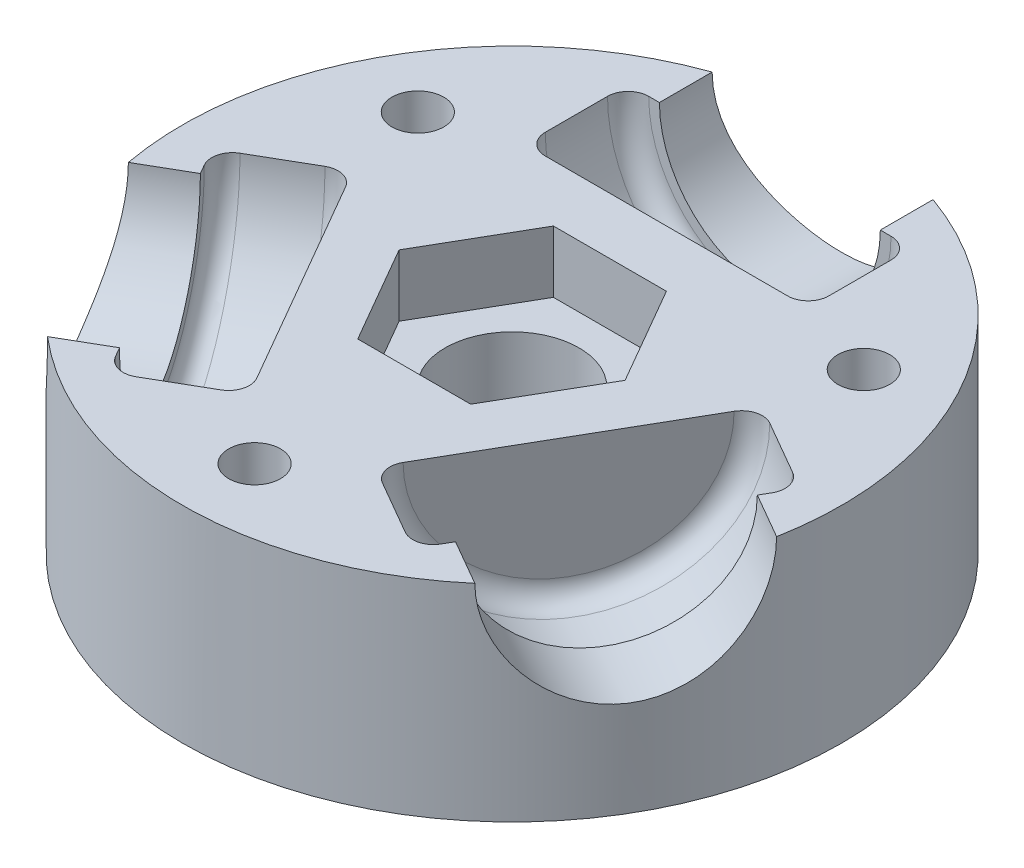
from build123d import *

# Parameters (mm, degrees)
SKETCH2_R                = 32
BOSS_EXTRUDE1_DEPTH      = 20
SKETCH3_R                = 10.725
CUT_EXTRUDE1_DEPTH       = 6.97
SKETCH4_R                = 13.765
CUT_EXTRUDE2_DEPTH       = 10.04
FILLET1_R                = 2
CIRPATTERN1_COUNT        = 3
FILLET1_OF_CIRPATTERN1_R = 2
SKETCH5_R                = 6.5
CUT_EXTRUDE3_DEPTH       = 20
SKETCH6_R                = 17.515
CUT_EXTRUDE4_DEPTH       = 3
SKETCH7_R                = 2.515
CUT_EXTRUDE5_DEPTH       = 20
CUT_EXTRUDE6_DEPTH       = 6


with BuildPart() as part:
    # Sketch2 → Boss-Extrude1 (new body)
    with BuildSketch(Plane(origin=(0, 0, 0), x_dir=(1, 0, 0), z_dir=(0, 1, 0))):
        with Locations(Location((0, 0, 0), (0, 0, 270))):
            Circle(SKETCH2_R)
    extrude(amount=BOSS_EXTRUDE1_DEPTH)

    # Sketch3 → Cut-Extrude1 (cut)
    with BuildSketch(Plane(origin=(0, 0, -32), x_dir=(-1, 0, 0), z_dir=(0, 0, -1))):
        with Locations((0, 20)):
            Circle(SKETCH3_R)
    cut_extrude1 = extrude(amount=-CUT_EXTRUDE1_DEPTH, mode=Mode.SUBTRACT)

    # Sketch4 → Cut-Extrude2 (cut)
    with BuildSketch(Plane(origin=(0, 0, -25.03), x_dir=(-1, 0, 0), z_dir=(0, 0, -1))):
        with Locations((0, 20)):
            Circle(SKETCH4_R)
    cut_extrude2 = extrude(amount=-CUT_EXTRUDE2_DEPTH, mode=Mode.SUBTRACT)

    # Fillet1
    fillet1_edges = [part.edges().sort_by_distance(p)[0] for p in [
        (0, 6.235, -25.03),
        (0, 6.235, -14.99),
    ]]
    fillet(fillet1_edges, radius=FILLET1_R)

    # CirPattern1: Cut-Extrude1, Cut-Extrude2 ×3 about axis
    cirpattern1_axis = Axis((0, 0, 0), (0, 1, 0))
    add([cut_extrude1.rotate(cirpattern1_axis, i * 360 / CIRPATTERN1_COUNT) for i in range(1, CIRPATTERN1_COUNT)], mode=Mode.SUBTRACT)
    add([cut_extrude2.rotate(cirpattern1_axis, i * 360 / CIRPATTERN1_COUNT) for i in range(1, CIRPATTERN1_COUNT)], mode=Mode.SUBTRACT)

    # Fillet1 of CirPattern1
    fillet1_of_cirpattern1_edges = [part.edges().sort_by_distance(p)[0] for p in [
        (-21.676615857, 6.235, 12.515),
        (-12.981720803, 6.235, 7.495),
        (21.676615857, 6.235, 12.515),
        (12.981720803, 6.235, 7.495),
    ]]
    fillet(fillet1_of_cirpattern1_edges, radius=FILLET1_OF_CIRPATTERN1_R)

    # Sketch5 → Cut-Extrude3 (cut)
    with BuildSketch(Plane(origin=(0, 20, 0), x_dir=(1, 0, 0), z_dir=(0, 1, 0))):
        with Locations(Location((0, 0, 0), (0, 0, 270))):
            Circle(SKETCH5_R)
    extrude(amount=-CUT_EXTRUDE3_DEPTH, mode=Mode.SUBTRACT)

    # Sketch6 → Cut-Extrude4 (cut)
    with BuildSketch(Plane(origin=(0, 0, 0), x_dir=(1, 0, 0), z_dir=(0, 1, 0))):
        with Locations(Location((0, 0, 0), (0, 0, 270))):
            Circle(SKETCH6_R)
    extrude(amount=CUT_EXTRUDE4_DEPTH, mode=Mode.SUBTRACT)

    # Sketch7 → Cut-Extrude5 (cut)
    with BuildSketch(Plane(origin=(0, 0, 0), x_dir=(1, 0, 0), z_dir=(0, 1, 0))):
        with Locations(Location((0, -25, 0), (0, 0, 90))):
            Circle(SKETCH7_R)
        with Locations(Location((-21.650635095, 12.5, 0), (0, 0, 90))):
            Circle(SKETCH7_R)
        with Locations(Location((21.650635095, 12.5, 0), (0, 0, 90))):
            Circle(SKETCH7_R)
    extrude(amount=CUT_EXTRUDE5_DEPTH, mode=Mode.SUBTRACT)

    # Sketch8 → Cut-Extrude6 (cut)
    with BuildSketch(Plane(origin=(0, 20, 0), x_dir=(1, 0, 0), z_dir=(0, 1, 0))):
        Polygon((5.484827557, 9.5), (-5.484827557, 9.5), (-10.969655115, 0), (-5.484827557, -9.5), (5.484827557, -9.5), (10.969655115, 0), align=None)
    extrude(amount=-CUT_EXTRUDE6_DEPTH, mode=Mode.SUBTRACT)


solid = part.part
